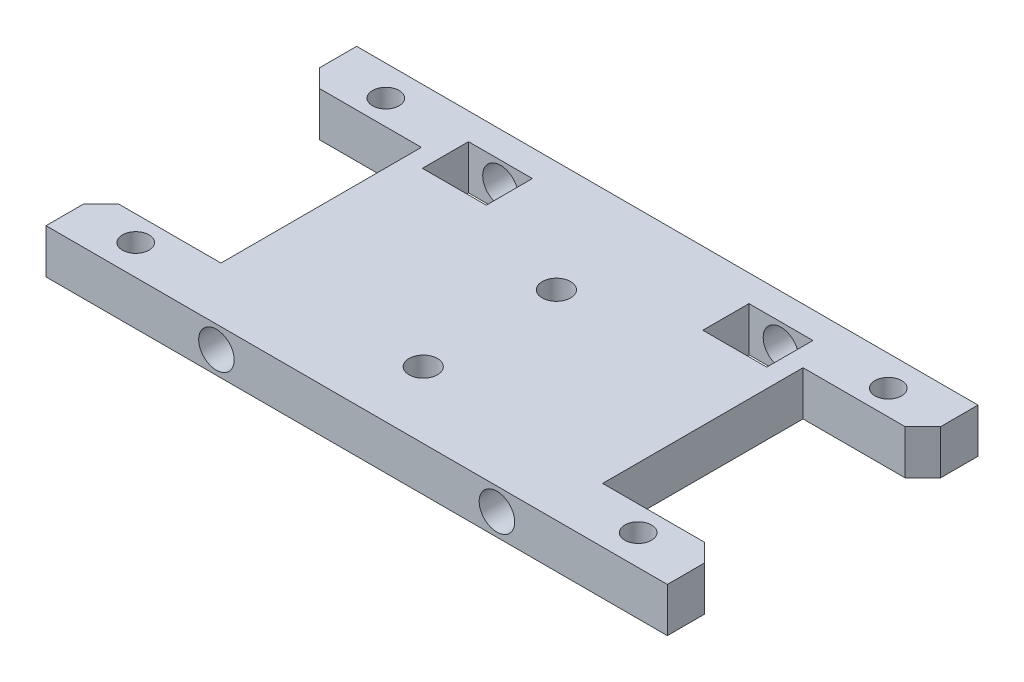
from build123d import *

# Parameters (mm, degrees)
SKETCH_1_R          = 1.5
SKETCH_1_R_2        = 1.6
EXTRUDE_1_DEPTH     = 5
CHAMFER_1_SIZE      = 2
SKETCH_2_R          = 2
CUT_EXTRUDE_1_DEPTH = 50.749371855
SKETCH_3_W          = 7.2
SKETCH_3_H          = 5.2
CUT_EXTRUDE_2_DEPTH = 40.449334595


with BuildPart() as part:
    # 草图1 → 凸台-拉伸1 (new body)
    with BuildSketch(Plane(origin=(0, 0, 0), x_dir=(1, 0, 0), z_dir=(0, 1, 0))):
        Polygon((35, 17.5), (-35, 17.5), (-35, 11.288596674), (-21.49999999, 11.288596674), (-21.49999999, -11.288596674), (-35, -11.288596674), (-35, -17.5), (35, -17.5), (35, -11.288596674), (21.49999999, -11.288596674), (21.49999999, 11.288596674), (35, 11.288596674), align=None)
        with Locations(Location((-28.303727501, -14.088596674, 0), (0, 0, 270))):
            Circle(SKETCH_1_R, mode=Mode.SUBTRACT)
        with Locations(Location((0, -10, 0), (0, 0, 270))):
            Circle(SKETCH_1_R_2, mode=Mode.SUBTRACT)
        with Locations(Location((28.303727501, -14.088596674, 0), (0, 0, 270))):
            Circle(SKETCH_1_R, mode=Mode.SUBTRACT)
        with Locations(Location((-28.303727501, 14.088596674, 0), (0, 0, 270))):
            Circle(SKETCH_1_R, mode=Mode.SUBTRACT)
        with Locations(Location((0, 5, 0), (0, 0, 270))):
            Circle(SKETCH_1_R_2, mode=Mode.SUBTRACT)
        with Locations(Location((28.303727501, 14.088596674, 0), (0, 0, 270))):
            Circle(SKETCH_1_R, mode=Mode.SUBTRACT)
    extrude(amount=EXTRUDE_1_DEPTH)

    # 倒角1
    chamfer_1_edges = [part.edges().sort_by_distance(p)[0] for p in [
        (35, 2.5, 11.288596674),
        (-35, 2.5, 11.288596674),
        (-35, 2.5, -11.288596674),
        (35, 2.5, -11.288596674),
    ]]
    chamfer(chamfer_1_edges, length=CHAMFER_1_SIZE)

    # 草图2 → 切除-拉伸1 (cut, through all)
    with BuildSketch(Plane.XY.offset(17.5)):
        with Locations((-15.8, 2.5)):
            Circle(SKETCH_2_R)
        with Locations(Location((15.8, 2.5, 0), (0, 0, 180))):
            Circle(SKETCH_2_R)
    extrude(amount=-CUT_EXTRUDE_1_DEPTH, mode=Mode.SUBTRACT)

    # 草图3 → 切除-拉伸2 (cut, through all)
    with BuildSketch(Plane(origin=(0, 5, 0), x_dir=(1, 0, 0), z_dir=(0, 1, 0))):
        with Locations((-15.8, 11.9)):
            Rectangle(SKETCH_3_W, SKETCH_3_H)
        with Locations((15.8, 11.9)):
            Rectangle(SKETCH_3_W, SKETCH_3_H)
    extrude(amount=-CUT_EXTRUDE_2_DEPTH, mode=Mode.SUBTRACT)


solid = part.part
